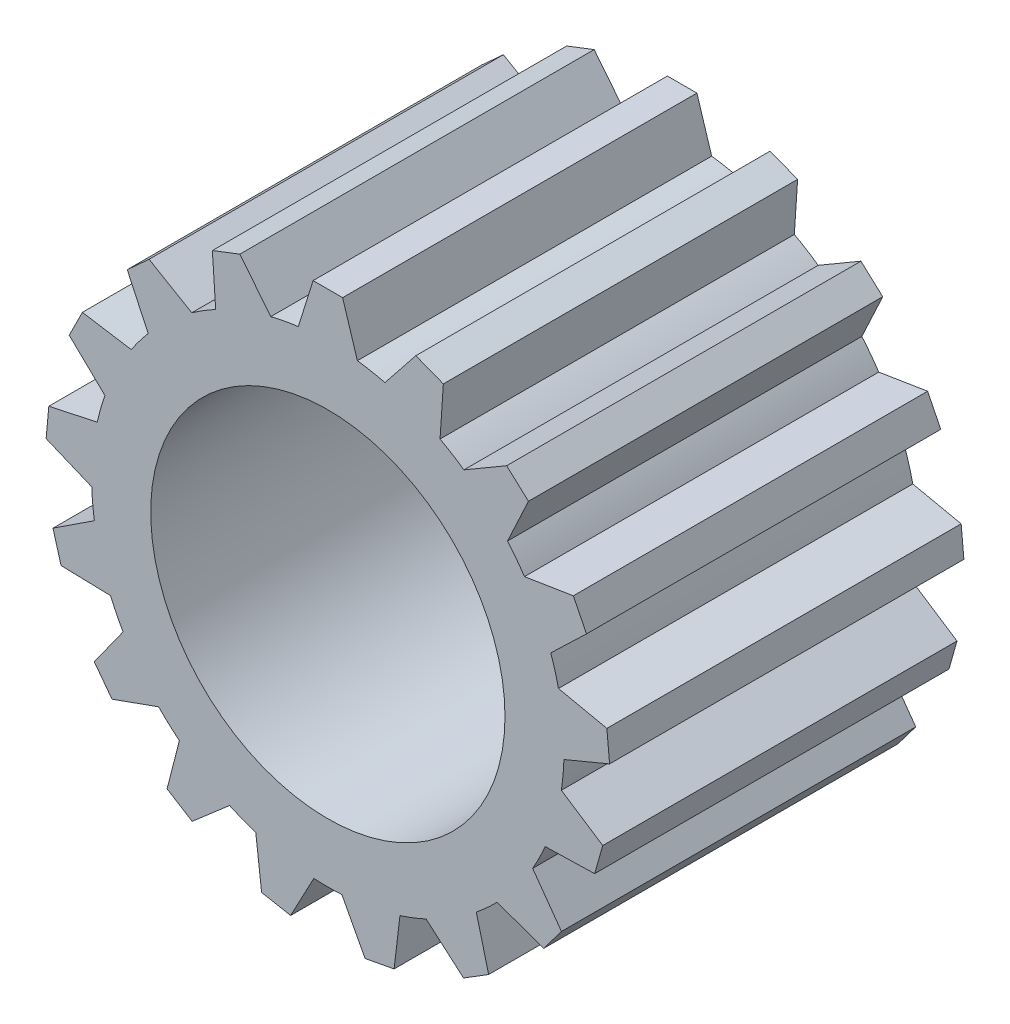
from build123d import *

# Parameters (mm, degrees)
SKETCH1_R           = 4
BOSS_EXTRUDE1_DEPTH = 6
BOSS_EXTRUDE2_DEPTH = 6
CIRPATTERN1_COUNT   = 17
SKETCH5_R           = 3
CUT_EXTRUDE1_DEPTH  = 6


with BuildPart() as part:
    # Sketch1 → Boss-Extrude1 (new body)
    with BuildSketch(Plane.XY):
        Circle(SKETCH1_R)
    extrude(amount=BOSS_EXTRUDE1_DEPTH)

    # Sketch3 → Boss-Extrude2 (add)
    with BuildSketch(Plane.XY):
        Polygon((0, 4.768626967), (0.25, 4.768626967), (0.5, 3.968626967), (-0.5, 3.968626967), (-0.25, 4.768626967), align=None)
    boss_extrude2 = extrude(amount=BOSS_EXTRUDE2_DEPTH)

    # CirPattern1: Boss-Extrude2 ×17 about axis
    cirpattern1_axis = Axis((0, 0, 0), (0, 0, 1))
    for i in range(1, CIRPATTERN1_COUNT):
        add(boss_extrude2.rotate(cirpattern1_axis, i * 360 / CIRPATTERN1_COUNT))

    # Sketch5 → Cut-Extrude1 (cut)
    with BuildSketch(Plane.XY):
        Circle(SKETCH5_R)
    extrude(amount=CUT_EXTRUDE1_DEPTH, mode=Mode.SUBTRACT)


solid = part.part
